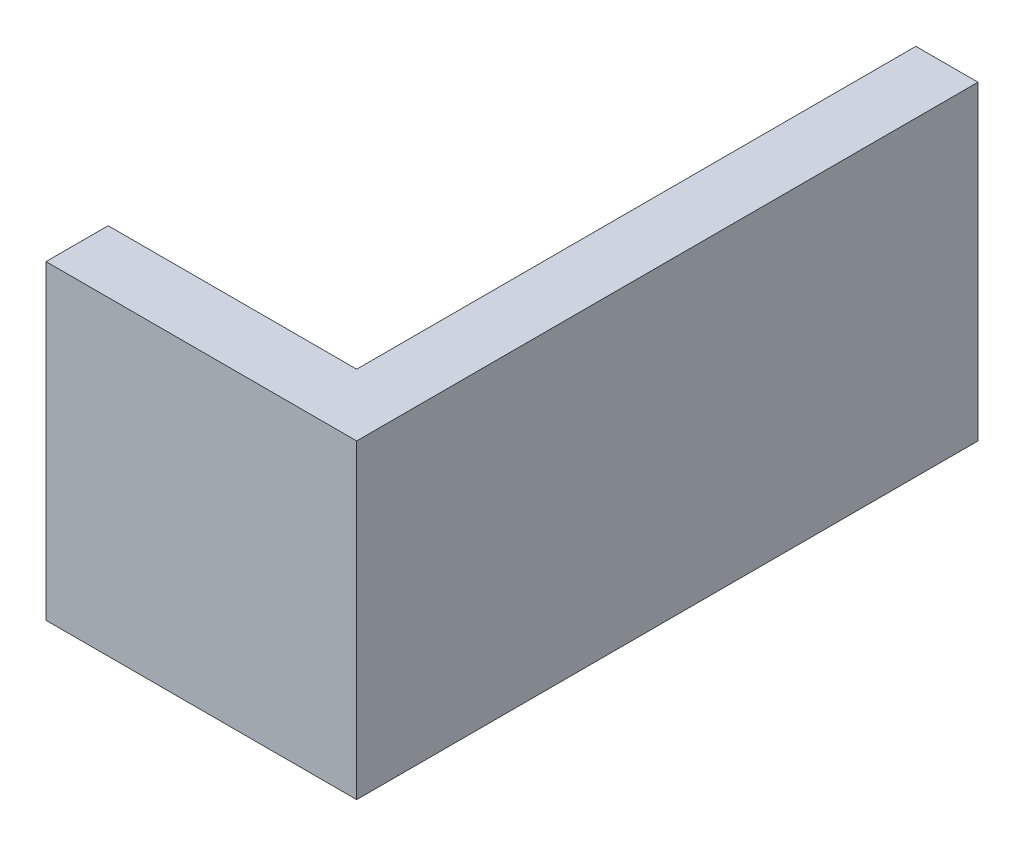
from build123d import *

# Parameters (mm, degrees)
BOSS_EXTRUDE1_DEPTH = 12.7


with BuildPart() as part:
    # Sketch2 → Boss-Extrude1 (new body)
    with BuildSketch(Plane(origin=(0, 0, 0), x_dir=(1, 0, 0), z_dir=(0, 1, 0))):
        Polygon((0, 0), (0, 22.86), (2.54, 22.86), (2.54, -2.54), (-10.16, -2.54), (-10.16, 0), align=None)
    extrude(amount=BOSS_EXTRUDE1_DEPTH)


solid = part.part
